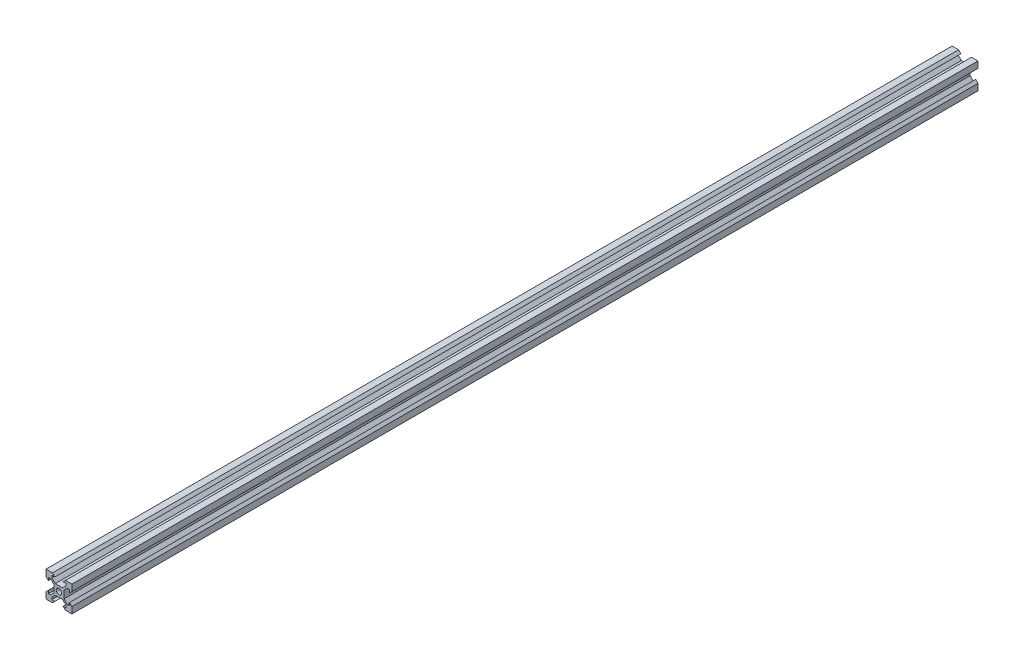
from build123d import *

# Parameters (mm, degrees)
SKETCH1_R           = 2.1
BOSS_EXTRUDE1_DEPTH = 700


with BuildPart() as part:
    # Sketch1 → Boss-Extrude1 (new body)
    with BuildSketch(Plane.XY):
        Polygon((-10, 10), (-10, 5), (-8.2, 3.2), (-8.2, 5.499339828), (-6.56, 5.499339828), (-3.900660172, 2.84), (-3.900660172, -2.84), (-6.56, -5.499339828), (-8.2, -5.499339828), (-8.2, -3.2), (-10, -5), (-10, -10), (-5, -10), (-3.2, -8.2), (-5.499339828, -8.2), (-5.499339828, -6.56), (-2.84, -3.900660172), (2.84, -3.900660172), (5.499339828, -6.56), (5.499339828, -8.2), (3.2, -8.2), (5, -10), (10, -10), (10, -5), (8.2, -3.2), (8.2, -5.499339828), (6.56, -5.499339828), (3.900660172, -2.84), (3.900660172, 2.84), (6.56, 5.499339828), (8.2, 5.499339828), (8.2, 3.2), (10, 5), (10, 10), (5, 10), (3.2, 8.2), (5.499339828, 8.2), (5.499339828, 6.56), (2.84, 3.900660172), (-2.84, 3.900660172), (-5.499339828, 6.56), (-5.499339828, 8.2), (-3.2, 8.2), (-5, 10), align=None)
        Circle(SKETCH1_R, mode=Mode.SUBTRACT)
    extrude(amount=-BOSS_EXTRUDE1_DEPTH)


solid = part.part
